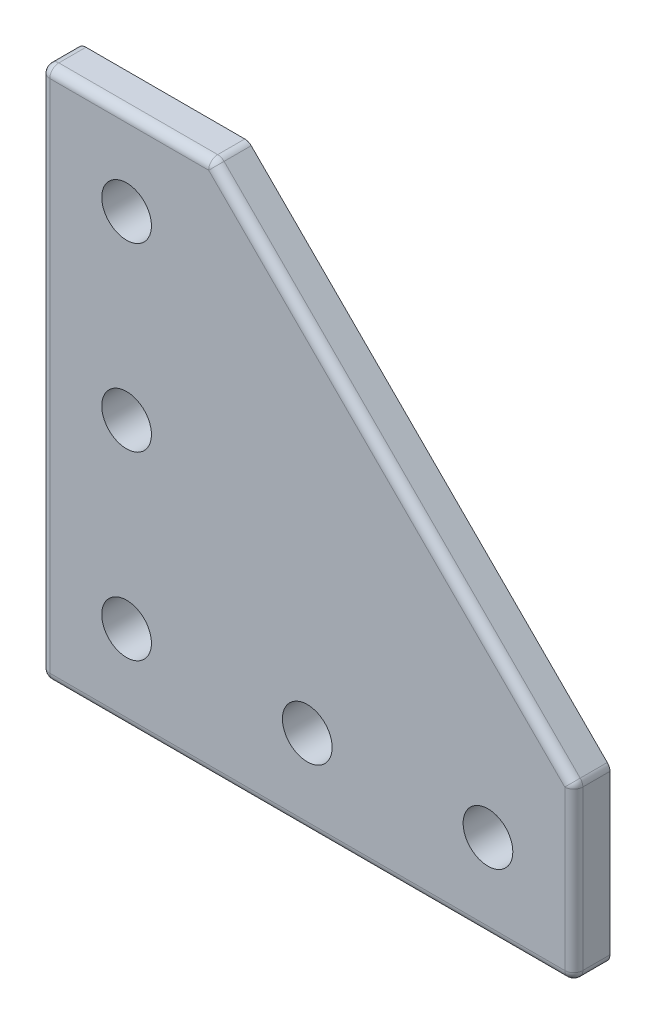
from build123d import *

# Parameters (mm, degrees)
SKETCH1_R           = 2.75
BOSS_EXTRUDE1_DEPTH = 2
FILLET1_R           = 1


with BuildPart() as part:
    # Sketch1 → Boss-Extrude1 (new, symmetric)
    with BuildSketch(Plane.XY):
        Polygon((0, 0), (0, 59), (19, 59), (59, 19), (59, 0), align=None)
        with Locations((9.5, 9.5)):
            Circle(SKETCH1_R, mode=Mode.SUBTRACT)
        with Locations((29.5, 9.5)):
            Circle(SKETCH1_R, mode=Mode.SUBTRACT)
        with Locations((49.5, 9.5)):
            Circle(SKETCH1_R, mode=Mode.SUBTRACT)
        with Locations((9.5, 29.5)):
            Circle(SKETCH1_R, mode=Mode.SUBTRACT)
        with Locations((9.5, 49.5)):
            Circle(SKETCH1_R, mode=Mode.SUBTRACT)
    extrude(amount=BOSS_EXTRUDE1_DEPTH, both=True)

    # Fillet1
    fillet1_edges = [part.edges().sort_by_distance(p)[0] for p in [
        (39, 39, 2),
        (9.5, 59, 2),
        (0, 29.5, 2),
        (29.5, 0, 2),
        (59, 9.5, 2),
        (0, 0, 0),
        (0, 59, 0),
        (19, 59, 0),
        (59, 19, 0),
        (59, 0, 0),
    ]]
    fillet(fillet1_edges, radius=FILLET1_R)


solid = part.part
